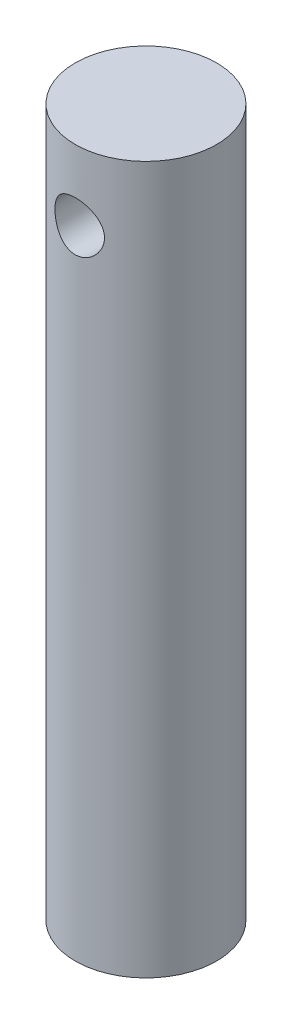
from build123d import *
from build123d.topology import SkipClean

# Parameters (mm, degrees)
ESQUISSE1_W             = 20
ESQUISSE1_H             = 100
ESQUISSE1_R             = 3.5
BOSS_EXTRU_1_DEPTH      = 20
ENL_V_MAT_EXTRU_1_DEPTH = 100


with BuildPart() as part:
    # Esquisse1 → Boss.-Extru.1 (new body)
    with BuildSketch(Plane.XY):
        with Locations((0, -40)):
            Rectangle(ESQUISSE1_W, ESQUISSE1_H)
        Circle(ESQUISSE1_R, mode=Mode.SUBTRACT)
    extrude(amount=BOSS_EXTRU_1_DEPTH)

    # Esquisse3 → Enlèv. mat.-Extru.1 (cut)
    with SkipClean():  # the faces are left unmerged after this step: merging them gives an invalid solid
        with BuildSketch(Plane(origin=(0, 10, 0), x_dir=(1, 0, 0), z_dir=(0, 1, 0))):
            with BuildLine():
                Line((-10, 0), (-10, -10))
                ThreePointArc((-10, -10), (-7.071067812, -2.928932188), (0, 0))
                Line((0, 0), (-10, 0))
            make_face()
            with BuildLine():
                Line((10, 0), (0, 0))
                ThreePointArc((0, 0), (7.071067812, -2.928932188), (10, -10))
                Line((10, -10), (10, 0))
            make_face()
            with BuildLine():
                ThreePointArc((10, -10), (7.071067812, -17.071067812), (0, -20))
                Line((0, -20), (10, -20))
                Line((10, -20), (10, -10))
            make_face()
            with BuildLine():
                ThreePointArc((0, -20), (-7.071067812, -17.071067812), (-10, -10))
                Line((-10, -10), (-10, -20))
                Line((-10, -20), (0, -20))
            make_face()
        extrude(amount=-ENL_V_MAT_EXTRU_1_DEPTH, mode=Mode.SUBTRACT)


solid = part.part
